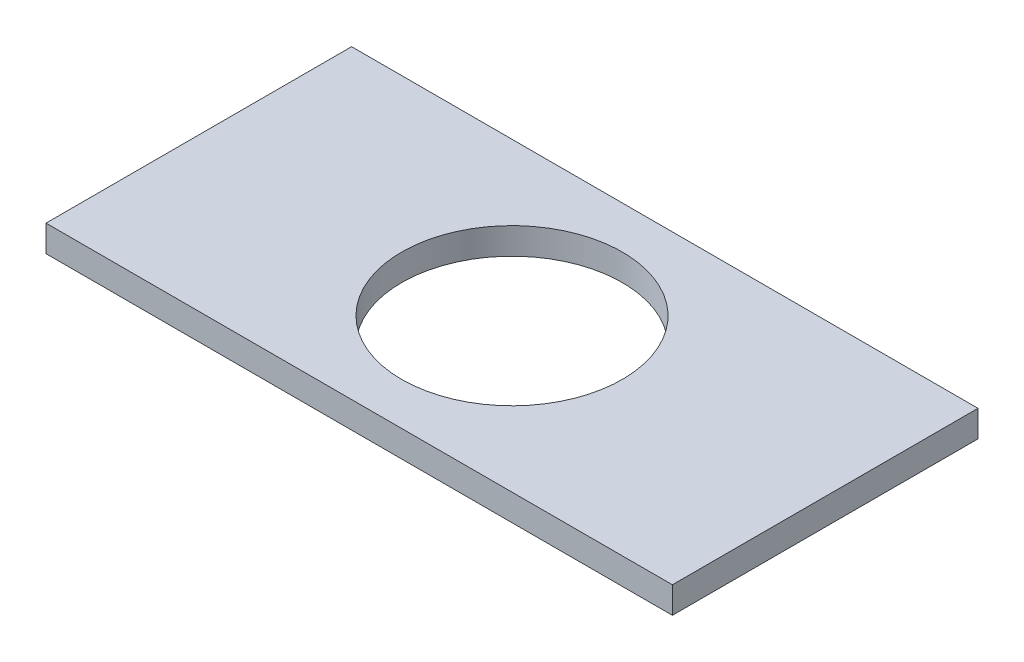
from build123d import *

# Parameters (mm, degrees)
SKETCH1_W           = 236.546508348
SKETCH1_H           = 115.41057828
SKETCH1_R           = 41.672667567
BOSS_EXTRUDE1_DEPTH = 10


with BuildPart() as part:
    # Sketch1 → Boss-Extrude1 (new body)
    with BuildSketch(Plane(origin=(0, 0, 0), x_dir=(1, 0, 0), z_dir=(0, 1, 0))):
        Rectangle(SKETCH1_W, SKETCH1_H)
        with Locations(Location((0, 0, 0), (0, 0, 270))):
            Circle(SKETCH1_R, mode=Mode.SUBTRACT)
    extrude(amount=BOSS_EXTRUDE1_DEPTH)


solid = part.part
